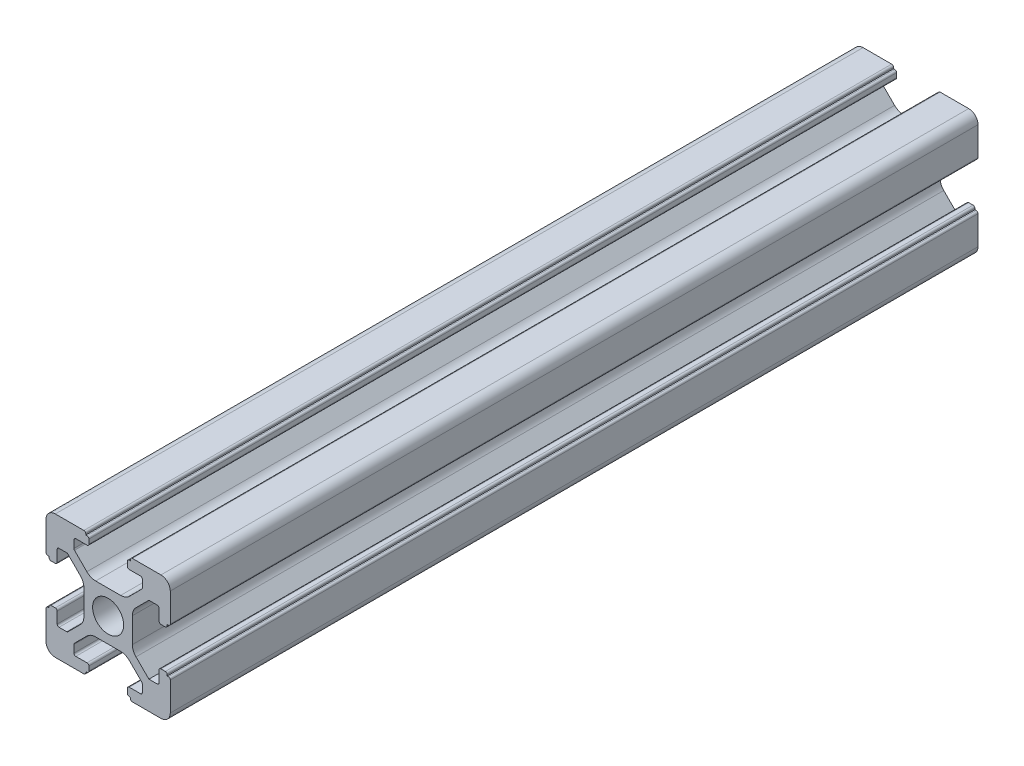
from build123d import *

# Parameters (mm, degrees)
SKETCH_1_R      = 2.5
EXTRUDE_1_DEPTH = 130


with BuildPart() as part:
    # 草图1 → 凸台-拉伸1 (new body)
    with BuildSketch(Plane.XY):
        with BuildLine():
            Line((3.9, 0), (3.9, -2.010912703))
            ThreePointArc((3.9, -2.010912703), (4.052240935, -2.776279568), (4.485786438, -3.425126266))
            Line((4.485786438, -3.425126266), (6.560660172, -5.5))
            Line((6.560660172, -5.5), (7.9, -5.5))
            ThreePointArc((7.9, -5.5), (8.112132034, -5.412132034), (8.2, -5.2))
            Line((8.2, -5.2), (8.2, -3.4))
            ThreePointArc((8.2, -3.4), (8.287867966, -3.187867966), (8.5, -3.1))
            Line((8.5, -3.1), (9.2, -3.1))
            ThreePointArc((9.2, -3.1), (9.412132034, -3.187867966), (9.5, -3.4))
            Line((9.5, -3.4), (9.5, -3.6))
            Line((9.5, -3.6), (9.7, -3.6))
            ThreePointArc((9.7, -3.6), (9.912132034, -3.687867966), (10, -3.9))
            Line((10, -3.9), (10, -8.5))
            ThreePointArc((10, -8.5), (9.560660172, -9.560660172), (8.5, -10))
            Line((8.5, -10), (3.9, -10))
            ThreePointArc((3.9, -10), (3.687867966, -9.912132034), (3.6, -9.7))
            ThreePointArc((3.6, -9.7), (3.541421356, -9.558578644), (3.4, -9.5))
            ThreePointArc((3.4, -9.5), (3.187867966, -9.412132034), (3.1, -9.2))
            Line((3.1, -9.2), (3.1, -8.5))
            ThreePointArc((3.1, -8.5), (3.187867966, -8.287867966), (3.4, -8.2))
            Line((3.4, -8.2), (5.2, -8.2))
            ThreePointArc((5.2, -8.2), (5.412132034, -8.112132034), (5.5, -7.9))
            Line((5.5, -7.9), (5.5, -6.68492424))
            ThreePointArc((5.5, -6.68492424), (5.47716386, -6.570119211), (5.412132034, -6.472792206))
            Line((5.412132034, -6.472792206), (3.425126266, -4.485786438))
            ThreePointArc((3.425126266, -4.485786438), (2.776279568, -4.052240935), (2.010912703, -3.9))
            Line((2.010912703, -3.9), (0, -3.9))
            Line((0, -3.9), (-2.010912703, -3.9))
            ThreePointArc((-2.010912703, -3.9), (-2.776279568, -4.052240935), (-3.425126266, -4.485786438))
            Line((-3.425126266, -4.485786438), (-5.412132034, -6.472792206))
            ThreePointArc((-5.412132034, -6.472792206), (-5.47716386, -6.570119211), (-5.5, -6.68492424))
            Line((-5.5, -6.68492424), (-5.5, -7.9))
            ThreePointArc((-5.5, -7.9), (-5.412132034, -8.112132034), (-5.2, -8.2))
            Line((-5.2, -8.2), (-3.4, -8.2))
            ThreePointArc((-3.4, -8.2), (-3.187867966, -8.287867966), (-3.1, -8.5))
            Line((-3.1, -8.5), (-3.1, -9.2))
            ThreePointArc((-3.1, -9.2), (-3.187867966, -9.412132034), (-3.4, -9.5))
            ThreePointArc((-3.4, -9.5), (-3.541421356, -9.558578644), (-3.6, -9.7))
            ThreePointArc((-3.6, -9.7), (-3.687867966, -9.912132034), (-3.9, -10))
            Line((-3.9, -10), (-8.5, -10))
            ThreePointArc((-8.5, -10), (-9.560660172, -9.560660172), (-10, -8.5))
            Line((-10, -8.5), (-10, -3.9))
            ThreePointArc((-10, -3.9), (-9.912132034, -3.687867966), (-9.7, -3.6))
            Line((-9.7, -3.6), (-9.5, -3.6))
            Line((-9.5, -3.6), (-9.5, -3.4))
            ThreePointArc((-9.5, -3.4), (-9.412132034, -3.187867966), (-9.2, -3.1))
            Line((-9.2, -3.1), (-8.5, -3.1))
            ThreePointArc((-8.5, -3.1), (-8.287867965, -3.187867966), (-8.2, -3.4))
            Line((-8.2, -3.4), (-8.2, -5.2))
            ThreePointArc((-8.2, -5.2), (-8.112132034, -5.412132034), (-7.9, -5.5))
            Line((-7.9, -5.5), (-6.68492424, -5.5))
            ThreePointArc((-6.68492424, -5.5), (-6.570119211, -5.47716386), (-6.472792206, -5.412132034))
            Line((-6.472792206, -5.412132034), (-4.485786438, -3.425126266))
            ThreePointArc((-4.485786438, -3.425126266), (-4.052240935, -2.776279568), (-3.9, -2.010912703))
            Line((-3.9, -2.010912703), (-3.9, 0))
            Line((-3.9, 0), (-3.9, 2.010912703))
            ThreePointArc((-3.9, 2.010912703), (-4.052240935, 2.776279568), (-4.485786438, 3.425126266))
            Line((-4.485786438, 3.425126266), (-6.472792206, 5.412132034))
            ThreePointArc((-6.472792206, 5.412132034), (-6.570119211, 5.47716386), (-6.68492424, 5.5))
            Line((-6.68492424, 5.5), (-7.9, 5.5))
            ThreePointArc((-7.9, 5.5), (-8.112132034, 5.412132034), (-8.2, 5.2))
            Line((-8.2, 5.2), (-8.2, 3.4))
            ThreePointArc((-8.2, 3.4), (-8.287867965, 3.187867966), (-8.5, 3.1))
            Line((-8.5, 3.1), (-9.2, 3.1))
            ThreePointArc((-9.2, 3.1), (-9.412132034, 3.187867966), (-9.5, 3.4))
            Line((-9.5, 3.4), (-9.5, 3.6))
            Line((-9.5, 3.6), (-9.7, 3.6))
            ThreePointArc((-9.7, 3.6), (-9.912132034, 3.687867966), (-10, 3.9))
            Line((-10, 3.9), (-10, 8.5))
            ThreePointArc((-10, 8.5), (-9.560660172, 9.560660172), (-8.5, 10))
            Line((-8.5, 10), (-3.9, 10))
            ThreePointArc((-3.9, 10), (-3.687867966, 9.912132034), (-3.6, 9.7))
            Line((-3.6, 9.7), (-3.6, 9.5))
            Line((-3.6, 9.5), (-3.4, 9.5))
            ThreePointArc((-3.4, 9.5), (-3.187867966, 9.412132034), (-3.1, 9.2))
            Line((-3.1, 9.2), (-3.1, 8.5))
            ThreePointArc((-3.1, 8.5), (-3.187867966, 8.287867966), (-3.4, 8.2))
            Line((-3.4, 8.2), (-5.2, 8.2))
            ThreePointArc((-5.2, 8.2), (-5.412132034, 8.112132034), (-5.5, 7.9))
            Line((-5.5, 7.9), (-5.5, 6.68492424))
            ThreePointArc((-5.5, 6.68492424), (-5.47716386, 6.570119211), (-5.412132034, 6.472792206))
            Line((-5.412132034, 6.472792206), (-3.425126266, 4.485786438))
            ThreePointArc((-3.425126266, 4.485786438), (-2.776279568, 4.052240935), (-2.010912703, 3.9))
            Line((-2.010912703, 3.9), (0, 3.9))
            Line((0, 3.9), (2.010912703, 3.9))
            ThreePointArc((2.010912703, 3.9), (2.776279568, 4.052240935), (3.425126266, 4.485786438))
            Line((3.425126266, 4.485786438), (5.412132034, 6.472792206))
            ThreePointArc((5.412132034, 6.472792206), (5.47716386, 6.570119211), (5.5, 6.68492424))
            Line((5.5, 6.68492424), (5.5, 7.9))
            ThreePointArc((5.5, 7.9), (5.412132034, 8.112132034), (5.2, 8.2))
            Line((5.2, 8.2), (3.4, 8.2))
            ThreePointArc((3.4, 8.2), (3.187867966, 8.287867966), (3.1, 8.5))
            Line((3.1, 8.5), (3.1, 9.2))
            ThreePointArc((3.1, 9.2), (3.187867966, 9.412132034), (3.4, 9.5))
            Line((3.4, 9.5), (3.6, 9.5))
            Line((3.6, 9.5), (3.6, 9.7))
            ThreePointArc((3.6, 9.7), (3.687867966, 9.912132034), (3.9, 10))
            Line((3.9, 10), (8.5, 10))
            ThreePointArc((8.5, 10), (9.560660172, 9.560660172), (10, 8.5))
            Line((10, 8.5), (10, 3.9))
            ThreePointArc((10, 3.9), (9.912132034, 3.687867966), (9.7, 3.6))
            Line((9.7, 3.6), (9.5, 3.6))
            Line((9.5, 3.6), (9.5, 3.4))
            ThreePointArc((9.5, 3.4), (9.412132034, 3.187867966), (9.2, 3.1))
            Line((9.2, 3.1), (8.5, 3.1))
            ThreePointArc((8.5, 3.1), (8.287867966, 3.187867966), (8.2, 3.4))
            Line((8.2, 3.4), (8.2, 5.2))
            ThreePointArc((8.2, 5.2), (8.112132034, 5.412132034), (7.9, 5.5))
            Line((7.9, 5.5), (6.68492424, 5.5))
            ThreePointArc((6.68492424, 5.5), (6.570119211, 5.47716386), (6.472792206, 5.412132034))
            Line((6.472792206, 5.412132034), (4.485786438, 3.425126266))
            ThreePointArc((4.485786438, 3.425126266), (4.052240935, 2.776279568), (3.9, 2.010912703))
            Line((3.9, 2.010912703), (3.9, 0))
        make_face()
        Circle(SKETCH_1_R, mode=Mode.SUBTRACT)
    extrude(amount=EXTRUDE_1_DEPTH)


solid = part.part
